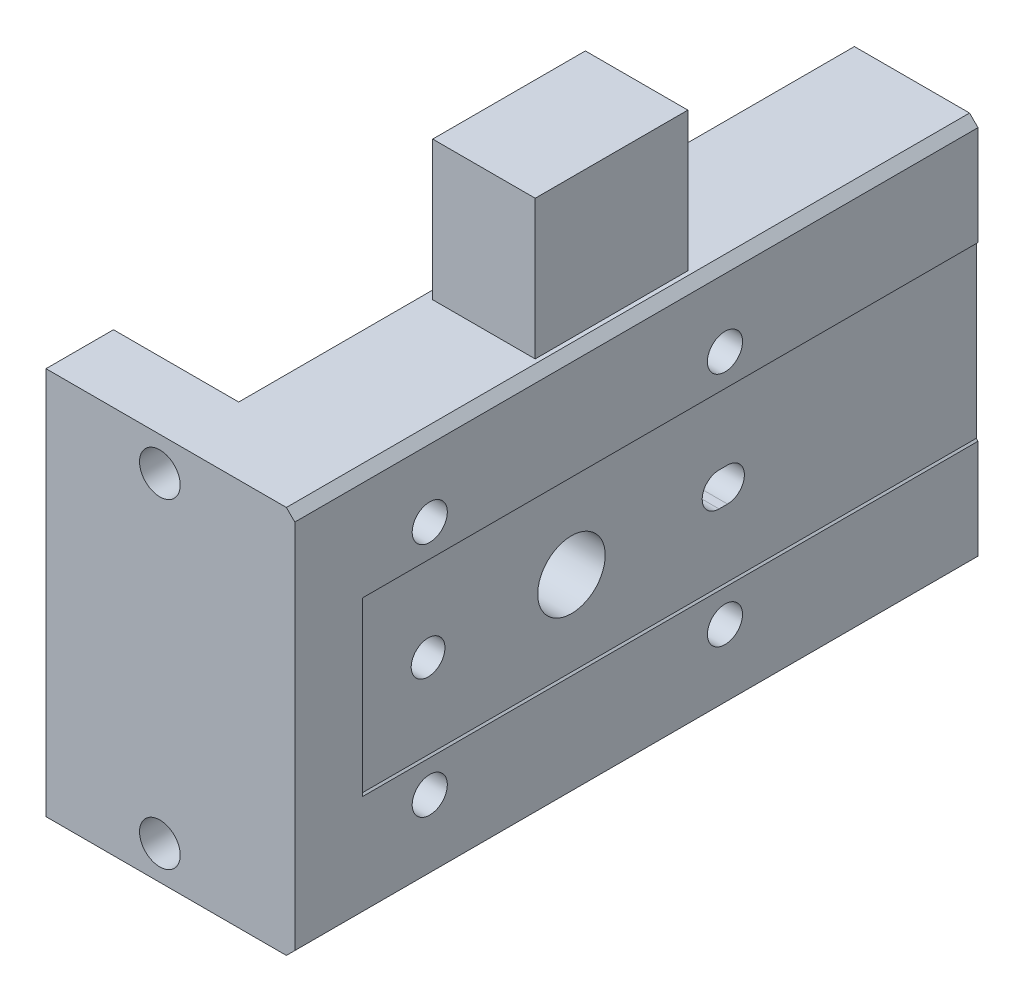
from build123d import *

# Parameters (mm, degrees)
BASE_EXTRUDE_DEPTH              = 8
BOSS_EXTRUDE1_DEPTH             = 73
BOSS_EXTRUDE3_DEPTH             = 8
F_8_0_DIAMETER_HOLE1_D          = 8
F_8_32_TAPPED_HOLE1_D           = 3.4544
F_8_32_TAPPED_HOLE1_DEPTH       = 12.2936
F_8_32_TAPPED_HOLE1_CBORE_D     = 4.1656
F_8_32_TAPPED_HOLE1_CBORE_DEPTH = 8.3312
F_8_32_TAPPED_HOLE1_TIP         = 1.037806461
F_10_32_TAPPED_HOLE1_D          = 4.826
CUT_EXTRUDE1_DEPTH              = 3.5
HOLE1_D                         = 4
HOLE1_DEPTH                     = 3.5
SKETCH14_W                      = 12.1518
SKETCH14_H                      = 18.1
BOSS_EXTRUDE2_DEPTH             = 16.5
CHAMFER1_SIZE                   = 1


with BuildPart() as part:
    # Sketch1 → Base-Extrude (new body)
    with BuildSketch(Plane.XY.offset(-1048.957398403)):
        Polygon((-6.1741, 23), (23.3259, 23), (23.3259, 10.2), (23.1259, 10), (23.1259, -10), (23.3259, -10.2), (23.3259, -23), (-6.1741, -23), align=None)
    extrude(amount=BASE_EXTRUDE_DEPTH)

    # Sketch3 → Boss-Extrude1 (add)
    with BuildSketch(Plane(origin=(0, 0, -1048.957398403), x_dir=(-1, 0, 0), z_dir=(0, 0, -1))):
        Polygon((-23.3259, 10.2), (-23.3259, 23), (-8.6741, 23), (-8.6741, -23), (-23.3259, -23), (-23.3259, -10.2), (-23.1259, -10), (-23.1259, 10), align=None)
    extrude(amount=BOSS_EXTRUDE1_DEPTH)

    # Sketch15 → Boss-Extrude3 (add)
    with BuildSketch(Plane.XY.offset(-1040.957398403)):
        Polygon((23.1259, -10), (23.1259, 10), (23.3259, 10.2), (23.3259, -10.2), align=None)
    extrude(amount=-BOSS_EXTRUDE3_DEPTH)

    # 8.0 Diameter Hole1 (through all)
    with Locations(Plane(origin=(23.1259, 0, 0), x_dir=(0, 0, -1), z_dir=(1, 0, 0))):
        with Locations((1073.957398403, 0)):
            Hole(F_8_0_DIAMETER_HOLE1_D / 2)

    # #8-32 Tapped Hole1
    with Locations(Plane(origin=(23.3259, 0, 0), x_dir=(0, 0, -1), z_dir=(1, 0, 0))):
        with Locations((1056.957398403, 14), (1091.957398403, 14), (1056.957398403, -14), (1091.957398403, -14)):
            CounterBoreHole(F_8_32_TAPPED_HOLE1_D / 2, F_8_32_TAPPED_HOLE1_CBORE_D / 2, F_8_32_TAPPED_HOLE1_CBORE_DEPTH, depth=F_8_32_TAPPED_HOLE1_DEPTH)
            with Locations((0, 0, -(F_8_32_TAPPED_HOLE1_DEPTH + F_8_32_TAPPED_HOLE1_TIP / 2))):  # 118° drill point
                Cone(0, F_8_32_TAPPED_HOLE1_D / 2, F_8_32_TAPPED_HOLE1_TIP, mode=Mode.SUBTRACT)

    # #10-32 Tapped Hole1 (through all)
    with Locations(Plane.XY.offset(-1040.957398403)):
        with Locations((7.3259, 19), (7.3259, -19)):
            Hole(F_10_32_TAPPED_HOLE1_D / 2)

    # Sketch11 → Cut-Extrude1 (cut)
    with BuildSketch(Plane(origin=(23.1259, 0, 0), x_dir=(0, 0, -1), z_dir=(1, 0, 0))):
        with BuildLine():
            Line((1091.457398403, 2), (1092.457398403, 2))
            ThreePointArc((1092.457398403, 2), (1094.457398403, 0), (1092.457398403, -2))
            Line((1092.457398403, -2), (1091.457398403, -2))
            ThreePointArc((1091.457398403, -2), (1089.457398403, 0), (1091.457398403, 2))
        make_face()
    extrude(amount=-CUT_EXTRUDE1_DEPTH, mode=Mode.SUBTRACT)

    # Hole1
    with Locations(Plane(origin=(23.1259, 0, 0), x_dir=(0, 0, -1), z_dir=(1, 0, 0))):
        with Locations((1056.957398403, 0)):
            Hole(HOLE1_D / 2, depth=HOLE1_DEPTH)

    # Sketch14 → Boss-Extrude2 (add)
    with BuildSketch(Plane(origin=(0, 23, 0), x_dir=(-1, 0, 0), z_dir=(0, 1, 0))):
        with Locations((-15.75, -1080.007398403)):
            Rectangle(SKETCH14_W, SKETCH14_H)
    extrude(amount=BOSS_EXTRUDE2_DEPTH)

    # Chamfer1
    chamfer1_edges = [part.edges().sort_by_distance(p)[0] for p in [
        (23.3259, -23, -1081.457398403),
        (23.3259, 23, -1081.457398403),
    ]]
    chamfer(chamfer1_edges, length=CHAMFER1_SIZE)


solid = part.part
